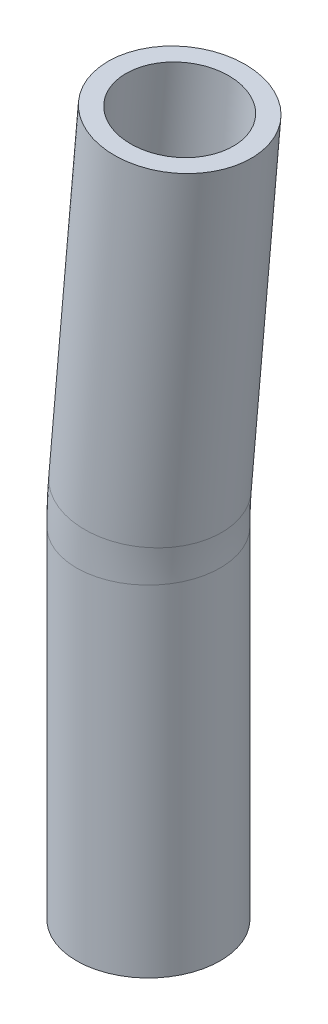
from build123d import *

# Parameters (mm, degrees)
SKETCH2_R   = 4
SKETCH2_R_2 = 3


with BuildPart() as part:
    # Sweep1: sweep along a path in Sketch1
    with BuildLine(Plane.XY) as sweep1_path:
        Line((0, 0), (0, 18.95213737))
        ThreePointArc((0, 18.95213737), (0.022842682, 19.999002667), (0.091327246, 21.043875196))
        Line((0.091327246, 21.043875196), (1.743114855, 39.923893962))
    # Sketch2 → Sweep1 (sweep)
    with BuildSketch(Plane(origin=(0, 0, 0), x_dir=(1, 0, 0), z_dir=(0, 1, 0))):
        Circle(SKETCH2_R)
        Circle(SKETCH2_R_2, mode=Mode.SUBTRACT)
    sweep(path=sweep1_path.line)


solid = part.part
